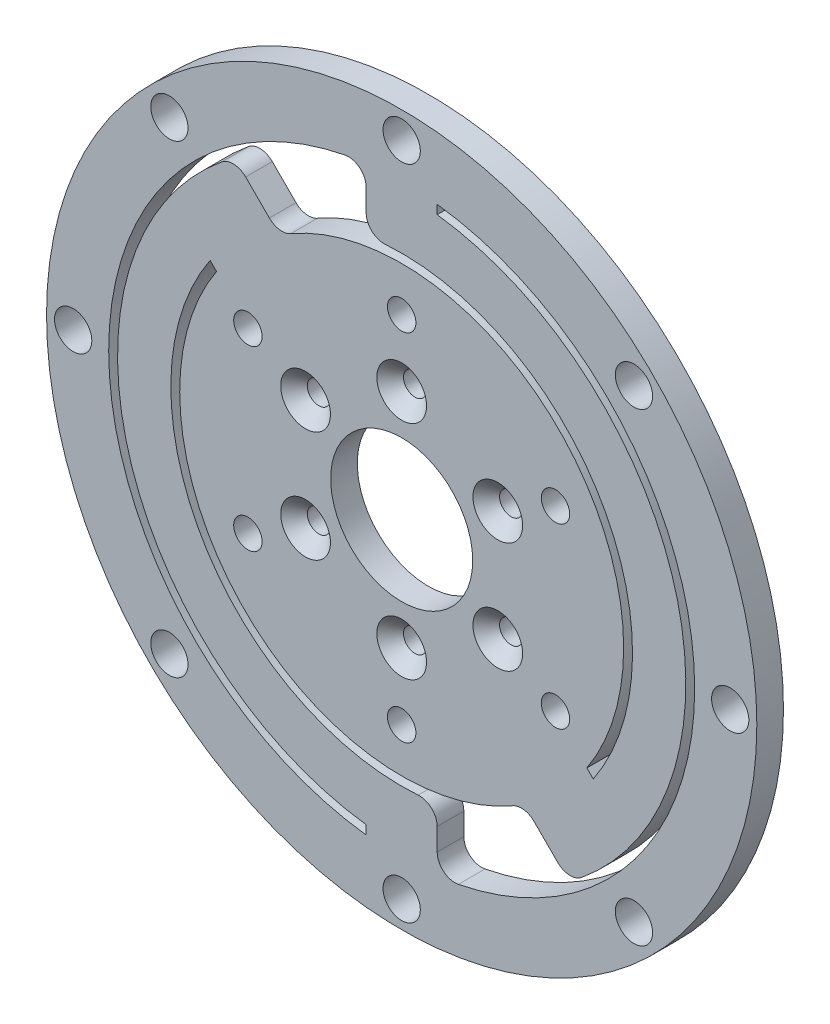
from build123d import *
from build123d.topology import SkipClean

# Parameters (mm, degrees)
SKETCH_1_R               = 40
SKETCH_1_R_2             = 8
SKETCH_1_R_3             = 2.1
SKETCH_1_R_4             = 1.6
SKETCH_1_R_5             = 1.3
EXTRUDE_1_DEPTH          = 3
CUT_EXTRUDE_1_DEPTH      = 10
PATTERN_CIRCULAR_1_COUNT = 2
CUT_EXTRUDE_2_DEPTH      = 10
FILLET_1_R               = 2
CHAMFER_1_SIZE           = 1.5


with BuildPart() as part:
    # 草图1 → 凸台-拉伸1 (new body)
    with BuildSketch(Plane.XY):
        Circle(SKETCH_1_R)
        Circle(SKETCH_1_R_2, mode=Mode.SUBTRACT)
        with Locations((0, 37)):
            Circle(SKETCH_1_R_3, mode=Mode.SUBTRACT)
        with Locations((26.162950904, 26.162950904)):
            Circle(SKETCH_1_R_3, mode=Mode.SUBTRACT)
        with Locations((37, 0)):
            Circle(SKETCH_1_R_3, mode=Mode.SUBTRACT)
        with Locations((26.162950904, -26.162950904)):
            Circle(SKETCH_1_R_3, mode=Mode.SUBTRACT)
        with Locations((0, -37)):
            Circle(SKETCH_1_R_3, mode=Mode.SUBTRACT)
        with Locations((-26.162950904, -26.162950904)):
            Circle(SKETCH_1_R_3, mode=Mode.SUBTRACT)
        with Locations((-37, 0)):
            Circle(SKETCH_1_R_3, mode=Mode.SUBTRACT)
        with Locations((-26.162950904, 26.162950904)):
            Circle(SKETCH_1_R_3, mode=Mode.SUBTRACT)
        with Locations((0, 20)):
            Circle(SKETCH_1_R_4, mode=Mode.SUBTRACT)
        with Locations((17.320508076, 10)):
            Circle(SKETCH_1_R_4, mode=Mode.SUBTRACT)
        with Locations((17.320508076, -10)):
            Circle(SKETCH_1_R_4, mode=Mode.SUBTRACT)
        with Locations((0, -20)):
            Circle(SKETCH_1_R_4, mode=Mode.SUBTRACT)
        with Locations((-17.320508076, -10)):
            Circle(SKETCH_1_R_4, mode=Mode.SUBTRACT)
        with Locations((-17.320508076, 10)):
            Circle(SKETCH_1_R_4, mode=Mode.SUBTRACT)
        with Locations((0, 12.5)):
            Circle(SKETCH_1_R_5, mode=Mode.SUBTRACT)
        with Locations((10.825317547, 6.25)):
            Circle(SKETCH_1_R_5, mode=Mode.SUBTRACT)
        with Locations((10.825317547, -6.25)):
            Circle(SKETCH_1_R_5, mode=Mode.SUBTRACT)
        with Locations((0, -12.5)):
            Circle(SKETCH_1_R_5, mode=Mode.SUBTRACT)
        with Locations((-10.825317547, -6.25)):
            Circle(SKETCH_1_R_5, mode=Mode.SUBTRACT)
        with Locations((-10.825317547, 6.25)):
            Circle(SKETCH_1_R_5, mode=Mode.SUBTRACT)
    extrude(amount=EXTRUDE_1_DEPTH)

    # 草图2 → 切除-拉伸1 (cut)
    with BuildSketch(Plane.XY.offset(3)):
        with BuildLine():
            Line((4, 32.756678708), (4, 31.749015733))
            ThreePointArc((4, 31.749015733), (30.992580507, 7.96617559), (18.813962733, -25.885030545))
            Line((18.813962733, -25.885030545), (13.78497417, -20.856041982))
            ThreePointArc((13.78497417, -20.856041982), (13.354474989, -21.134284889), (12.918361615, -21.403642989))
            Line((12.918361615, -21.403642989), (18.702947124, -27.188228498))
            ThreePointArc((18.702947124, -27.188228498), (32.050022263, 7.861047829), (4, 32.756678708))
        make_face()
        with BuildLine():
            Line((-4, 32.756678708), (-4, 25.690465157))
            ThreePointArc((-4, 25.690465157), (21.935809221, 13.957803331), (21.577152459, -14.506084647))
            Line((21.577152459, -14.506084647), (20.856041982, -13.78497417))
            ThreePointArc((20.856041982, -13.78497417), (20.716917223, 13.993189086), (-5, 24.494897428))
            Line((-5, 24.494897428), (-5, 32.619012861))
            ThreePointArc((-5, 32.619012861), (-4.50052641, 32.691669612), (-4, 32.756678708))
        make_face()
    cut_extrude_1 = extrude(amount=-CUT_EXTRUDE_1_DEPTH, mode=Mode.SUBTRACT)

    # 阵列(圆周)1: 切除-拉伸1 ×2 about axis
    pattern_circular_1_axis = Axis((0, 0, 0), (0, 0, 1))
    for i in range(1, PATTERN_CIRCULAR_1_COUNT):
        add(cut_extrude_1.rotate(pattern_circular_1_axis, i * 360 / PATTERN_CIRCULAR_1_COUNT), mode=Mode.SUBTRACT)

    # 草图3 → 切除-拉伸2 (cut)
    with SkipClean():  # the faces are left unmerged after this step: merging them gives an invalid solid
        with BuildSketch(Plane.XY.offset(3)):
            with BuildLine():
                Line((-5, 32.619012861), (-5, 24.494897428))
                ThreePointArc((-5, 24.494897428), (-9.091528158, 23.2882828), (-12.918361615, 21.403642989))
                Line((-12.918361615, 21.403642989), (-18.702947124, 27.188228498))
                ThreePointArc((-18.702947124, 27.188228498), (-12.158568184, 30.678481379), (-5, 32.619012861))
            make_face()
            with BuildLine():
                Line((12.918361615, -21.403642989), (18.702947124, -27.188228498))
                ThreePointArc((18.702947124, -27.188228498), (12.158568184, -30.678481379), (5, -32.619012861))
                Line((5, -32.619012861), (5, -24.494897428))
                ThreePointArc((5, -24.494897428), (9.091528158, -23.2882828), (12.918361615, -21.403642989))
            make_face()
        extrude(amount=-CUT_EXTRUDE_2_DEPTH, mode=Mode.SUBTRACT)

    # 圆角1
    fillet_1_edges = [part.edges().sort_by_distance(p)[0] for p in [
        (-4, 32.756678708, 1.5),
        (-4, 25.690465157, 1.5),
        (13.78497417, -20.856041982, 1.5),
        (18.813962733, -25.885030545, 1.5),
        (4, -32.756678708, 1.5),
        (4, -25.690465157, 1.5),
        (-13.78497417, 20.856041982, 1.5),
        (-18.813962733, 25.885030545, 1.5),
    ]]
    fillet(fillet_1_edges, radius=FILLET_1_R)

    # 倒角1
    chamfer_1_edges = [part.edges().sort_by_distance(p)[0] for p in [
        (-1.3, 12.5, 3),
        (9.525317547, 6.25, 3),
        (9.525317547, -6.25, 3),
        (-1.3, -12.5, 3),
        (-12.125317547, -6.25, 3),
        (-12.125317547, 6.25, 3),
    ]]
    chamfer(chamfer_1_edges, length=CHAMFER_1_SIZE)


solid = part.part
